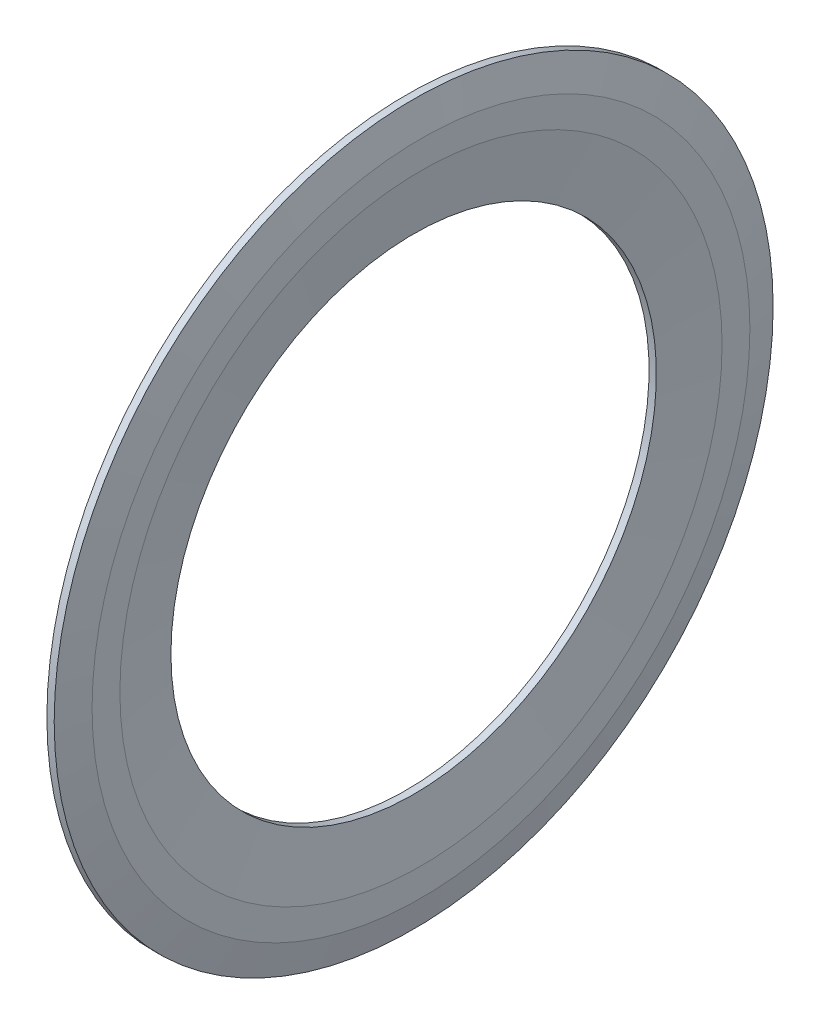
from build123d import *


with BuildPart() as part:
    # Sketch1 → Revolve1 (revolve)
    with BuildSketch(Plane.XY, mode=Mode.PRIVATE) as revolve1_sk:
        Polygon((0.357452, 5.85), (0.417027, 5.375), (0.357452, 4.9), (0.357452, 3.95), (0.476602, 3.95), (0.595752, 4.9), (0.595752, 5.352584122), (0.476602, 5.85), align=None)
    revolve(revolve1_sk.sketch.rotate(Axis((0.476602, 0, 0), (-1, 0, 0)), 270), axis=Axis((0.476602, 0, 0), (-1, 0, 0)))


solid = part.part
